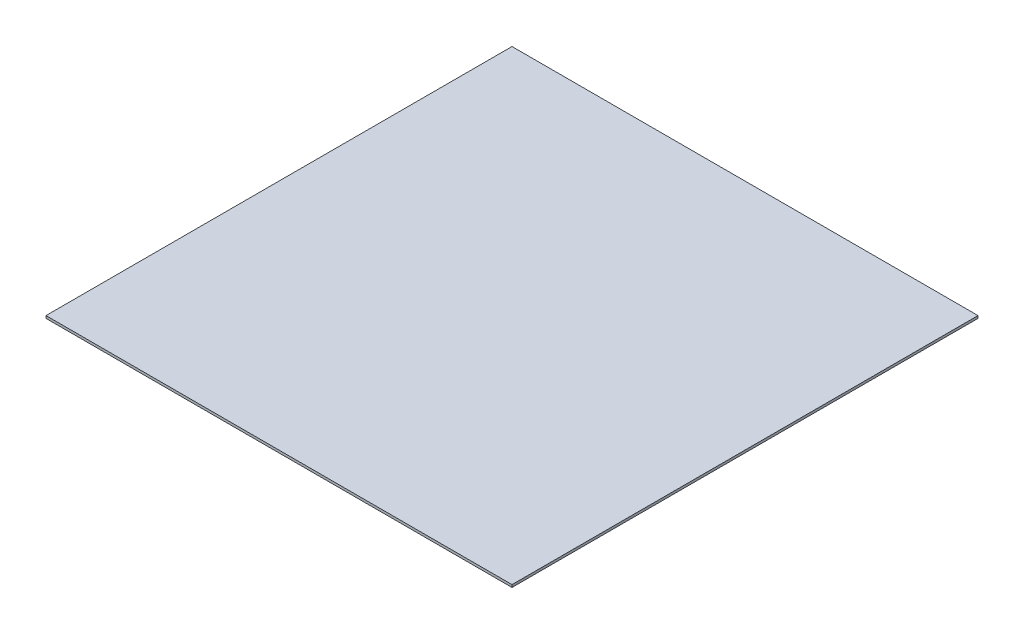
from build123d import *

# Parameters (mm, degrees)
SKETCH2_W           = 300
SKETCH2_H           = 300
BOSS_EXTRUDE1_DEPTH = 1.6


with BuildPart() as part:
    # Sketch2 → Boss-Extrude1 (new body)
    with BuildSketch(Plane(origin=(0, 0, 0), x_dir=(1, 0, 0), z_dir=(0, 1, 0))):
        Rectangle(SKETCH2_W, SKETCH2_H)
    extrude(amount=BOSS_EXTRUDE1_DEPTH)


solid = part.part
